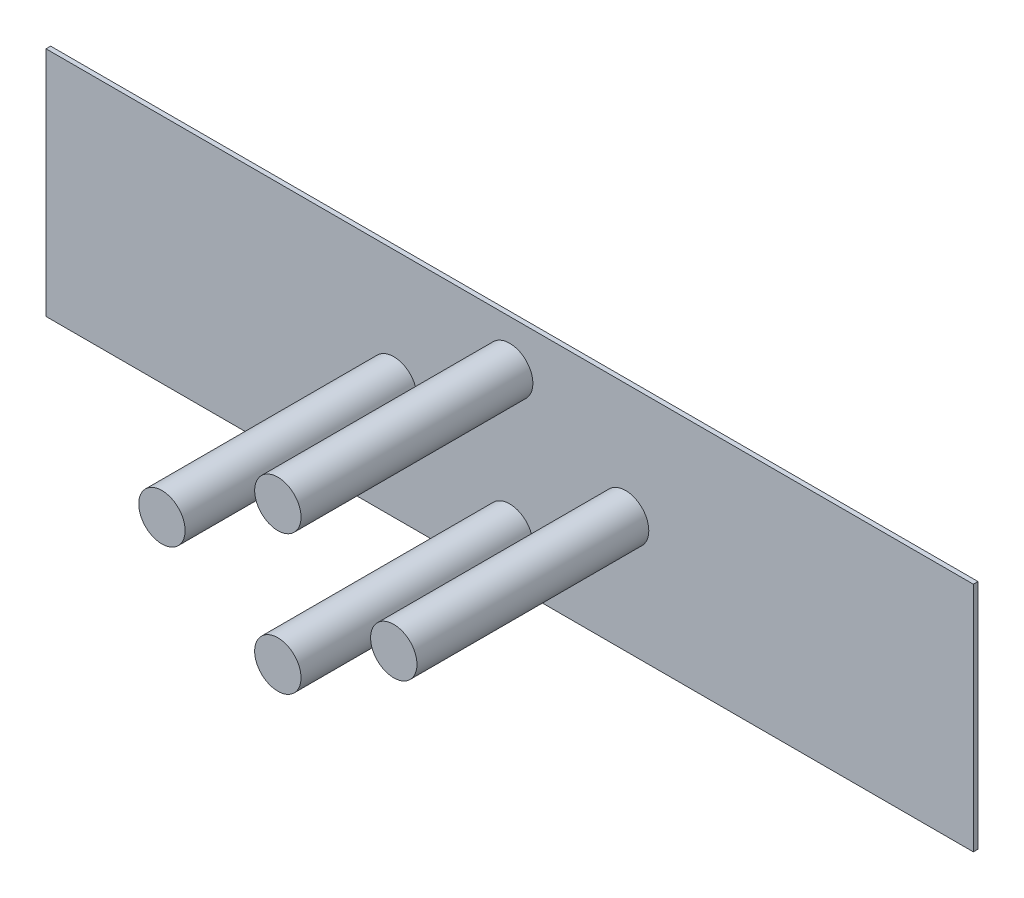
from build123d import *

# Parameters (mm, degrees)
SKETCH1_W           = 20000
SKETCH1_H           = 5000
BOSS_EXTRUDE1_DEPTH = 100
SKETCH3_R           = 500
BOSS_EXTRUDE2_DEPTH = 5000


with BuildPart() as part:
    # Sketch1 → Boss-Extrude1 (new body)
    with BuildSketch(Plane.XY):
        with Locations((-5000, 0)):
            Rectangle(SKETCH1_W, SKETCH1_H)
    extrude(amount=-BOSS_EXTRUDE1_DEPTH)

    # Sketch3 → Boss-Extrude2 (add)
    with BuildSketch(Plane.XY):
        with Locations((-5000, 1500)):
            Circle(SKETCH3_R)
        with BuildLine():
            ThreePointArc((-2000, 0), (-2500, 500), (-3000, 0))
            Line((-3000, 0), (-2000, 0))
        make_face()
        with BuildLine():
            Line((-2000, 0), (-3000, 0))
            ThreePointArc((-3000, 0), (-2500, -500), (-2000, 0))
        make_face()
        with Locations((-5000, -1500)):
            Circle(SKETCH3_R)
        with Locations((-7500, 0)):
            Circle(SKETCH3_R)
    extrude(amount=BOSS_EXTRUDE2_DEPTH)


solid = part.part
